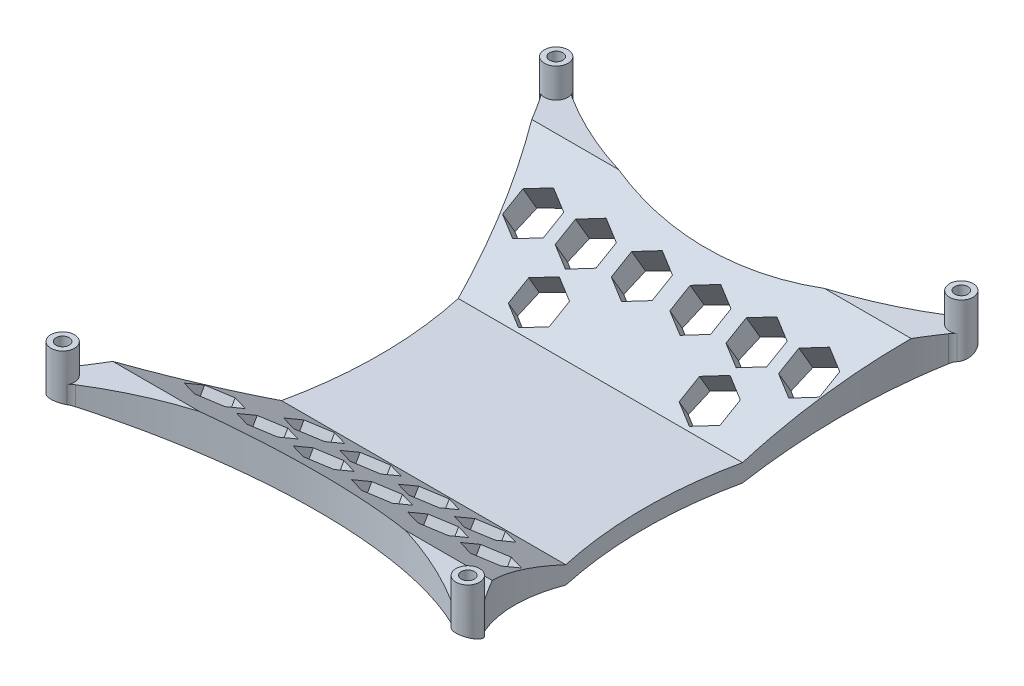
from build123d import *

# Parameters (mm, degrees)
SKETCH2_R                       = 1.4224
BOSS_EXTRUDE1_DEPTH             = 19.05
CUT_EXTRUDE1_DEPTH              = 143.46448246
CUT_EXTRUDE3_DEPTH              = 143.46448246
CUT_EXTRUDE3_DEPTH_BACK         = 143.46448246
SKETCH5_R                       = 2.54
SKETCH5_R_2                     = 1.4224
BOSS_EXTRUDE2_DEPTH             = 6.35
BOSS_EXTRUDE3_DEPTH             = 7.9375
BOSS_EXTRUDE4_REACH             = 145.452
BOSS_EXTRUDE4_DIRECTION_2_REACH = 145.452
BOSS_EXTRUDE5_REACH             = 145.452
SKETCH8_R                       = 6.35
CUT_EXTRUDE4_DEPTH              = 140.610682758
CUT_EXTRUDE5_DEPTH              = 7.9375


with BuildPart() as part:
    # Sketch2 → Boss-Extrude1 (new body)
    with BuildSketch(Plane(origin=(0, 0, 0), x_dir=(1, 0, 0), z_dir=(0, 1, 0))):
        with BuildLine():
            Line((4.399409051, -106.3625), (82.913090949, -106.3625))
            ThreePointArc((82.913090949, -106.3625), (84.183090949, -106.702795474), (85.112795474, -107.6325))
            ThreePointArc((85.112795474, -107.6325), (86.0425, -108.562204526), (87.3125, -108.9025))
            ThreePointArc((87.3125, -108.9025), (89.108551224, -108.158551224), (89.8525, -106.3625))
            ThreePointArc((89.8525, -106.3625), (89.512204526, -105.0925), (88.5825, -104.162795474))
            ThreePointArc((88.5825, -104.162795474), (87.652795474, -103.233090949), (87.3125, -101.963090949))
            Line((87.3125, -101.963090949), (87.3125, -4.399409051))
            ThreePointArc((87.3125, -4.399409051), (87.652795474, -3.129409051), (88.5825, -2.199704526))
            ThreePointArc((88.5825, -2.199704526), (89.512204526, -1.27), (89.8525, 0))
            ThreePointArc((89.8525, 0), (89.108551224, 1.796051224), (87.3125, 2.54))
            ThreePointArc((87.3125, 2.54), (86.0425, 2.199704526), (85.112795474, 1.27))
            ThreePointArc((85.112795474, 1.27), (84.183090949, 0.340295474), (82.913090949, 0))
            Line((82.913090949, 0), (4.399409051, 0))
            ThreePointArc((4.399409051, 0), (3.129409051, 0.340295474), (2.199704526, 1.27))
            ThreePointArc((2.199704526, 1.27), (1.27, 2.199704526), (0, 2.54))
            ThreePointArc((0, 2.54), (-1.796051224, 1.796051224), (-2.54, 0))
            ThreePointArc((-2.54, 0), (-2.199704526, -1.27), (-1.27, -2.199704526))
            ThreePointArc((-1.27, -2.199704526), (-0.340295474, -3.129409051), (0, -4.399409051))
            Line((0, -4.399409051), (0, -101.963090949))
            ThreePointArc((0, -101.963090949), (-0.340295474, -103.233090949), (-1.27, -104.162795474))
            ThreePointArc((-1.27, -104.162795474), (-2.199704526, -105.0925), (-2.54, -106.3625))
            ThreePointArc((-2.54, -106.3625), (-1.796051224, -108.158551224), (0, -108.9025))
            ThreePointArc((0, -108.9025), (1.27, -108.562204526), (2.199704526, -107.6325))
            ThreePointArc((2.199704526, -107.6325), (3.129409051, -106.702795474), (4.399409051, -106.3625))
        make_face()
        with Locations(Location((0, 0, 0), (0, 0, 90))):
            Circle(SKETCH2_R, mode=Mode.SUBTRACT)
        with Locations(Location((87.3125, 0, 0), (0, 0, 90))):
            Circle(SKETCH2_R, mode=Mode.SUBTRACT)
        with Locations(Location((0, -106.3625, 0), (0, 0, 90))):
            Circle(SKETCH2_R, mode=Mode.SUBTRACT)
        with Locations(Location((87.3125, -106.3625, 0), (0, 0, 90))):
            Circle(SKETCH2_R, mode=Mode.SUBTRACT)
    extrude(amount=BOSS_EXTRUDE1_DEPTH)

    # Sketch3 → Cut-Extrude1 (cut, through all)
    with BuildSketch(Plane.XZ):
        with BuildLine():
            Line((3.129409051, 106.702795474), (84.183090949, 106.702795474))
            ThreePointArc((84.183090949, 106.702795474), (43.65625, 95.031976181), (3.129409051, 106.702795474))
        make_face()
        with BuildLine():
            Line((-0.340295474, 103.233090949), (-0.340295474, 3.129409051))
            ThreePointArc((-0.340295474, 3.129409051), (15.088463774, 53.18125), (-0.340295474, 103.233090949))
        make_face()
        with BuildLine():
            Line((3.129409051, -0.340295474), (84.183090949, -0.340295474))
            ThreePointArc((84.183090949, -0.340295474), (43.65625, 11.330523819), (3.129409051, -0.340295474))
        make_face()
        with BuildLine():
            Line((87.652795474, 103.233090949), (87.652795474, 3.129409051))
            ThreePointArc((87.652795474, 3.129409051), (72.224036226, 53.18125), (87.652795474, 103.233090949))
        make_face()
    extrude(amount=-CUT_EXTRUDE1_DEPTH, mode=Mode.SUBTRACT)

    # Sketch4 → Cut-Extrude3 (cut, two sides: drawn at the far end of the back side and taken through both)
    with BuildSketch(Plane(origin=(0, 0, 0), x_dir=(0, 0, -1), z_dir=(1, 0, 0)).offset(-CUT_EXTRUDE3_DEPTH_BACK)):
        Polygon((-108.9025, 15.875), (-108.9025, 0), (-72.23125, 0), align=None)
        Polygon((-98.333998438, 19.05), (-72.23125, 3.81), (-34.13125, 3.81), (-8.028501562, 19.05), align=None)
        Polygon((-34.13125, 0), (2.54, 15.875), (2.54, 0), align=None)
    extrude(amount=CUT_EXTRUDE3_DEPTH + CUT_EXTRUDE3_DEPTH_BACK, mode=Mode.SUBTRACT)

    # Sketch5 → Boss-Extrude2 (add)
    # profile 1 of 4: a face of its own
    with BuildSketch(Plane(origin=(0, 19.05, 0), x_dir=(1, 0, 0), z_dir=(0, 1, 0))):
        with Locations(Location((0, 0, 0), (0, 0, 30))):
            Circle(SKETCH5_R)
        with Locations(Location((0, 0, 0), (0, 0, 270))):
            Circle(SKETCH5_R_2, mode=Mode.SUBTRACT)
    # profile 2 of 4: a face of its own
    with BuildSketch(Plane(origin=(0, 19.05, 0), x_dir=(1, 0, 0), z_dir=(0, 1, 0))):
        with Locations(Location((87.3125, 0, 0), (0, 0, 150))):
            Circle(SKETCH5_R)
        with Locations(Location((87.3125, 0, 0), (0, 0, 270))):
            Circle(SKETCH5_R_2, mode=Mode.SUBTRACT)
    # profile 3 of 4: a face of its own
    with BuildSketch(Plane(origin=(0, 19.05, 0), x_dir=(1, 0, 0), z_dir=(0, 1, 0))):
        with Locations(Location((87.3125, -106.3625, 0), (0, 0, 60))):
            Circle(SKETCH5_R)
        with Locations(Location((87.3125, -106.3625, 0), (0, 0, 90))):
            Circle(SKETCH5_R_2, mode=Mode.SUBTRACT)
    # profile 4 of 4: a face of its own
    with BuildSketch(Plane(origin=(0, 19.05, 0), x_dir=(1, 0, 0), z_dir=(0, 1, 0))):
        with Locations(Location((0, -106.3625, 0), (0, 0, 120))):
            Circle(SKETCH5_R)
        with Locations(Location((0, -106.3625, 0), (0, 0, 90))):
            Circle(SKETCH5_R_2, mode=Mode.SUBTRACT)
    extrude(amount=BOSS_EXTRUDE2_DEPTH)

    # Sketch6 → Boss-Extrude3 (add)
    with BuildSketch(Plane.XZ):
        with BuildLine():
            Line((29.81325, 62.606225546), (29.81325, 70.680274454))
            ThreePointArc((29.81325, 70.680274454), (29.387260417, 71.364190385), (28.585583333, 71.283431611))
            Line((28.585583333, 71.283431611), (23.356606545, 67.246407157))
            ThreePointArc((23.356606545, 67.246407157), (23.060273212, 66.64325), (23.356606545, 66.040092843))
            Line((23.356606545, 66.040092843), (28.585583333, 62.003068389))
            ThreePointArc((28.585583333, 62.003068389), (29.387260417, 61.922309615), (29.81325, 62.606225546))
        make_face()
        with BuildLine():
            Line((57.49925, 62.606225546), (57.49925, 70.680274454))
            ThreePointArc((57.49925, 70.680274454), (57.925239583, 71.364190385), (58.726916667, 71.283431611))
            Line((58.726916667, 71.283431611), (63.955893455, 67.246407157))
            ThreePointArc((63.955893455, 67.246407157), (64.252226788, 66.64325), (63.955893455, 66.040092843))
            Line((63.955893455, 66.040092843), (58.726916667, 62.003068389))
            ThreePointArc((58.726916667, 62.003068389), (57.925239583, 61.922309615), (57.49925, 62.606225546))
        make_face()
    extrude(amount=BOSS_EXTRUDE3_DEPTH)

    # Boss-Extrude4: up to this face of the body (flat: up to its plane)
    boss_extrude4_end = Plane(part.part.faces().sort_by_distance((27.368435666, -7.9375, 66.64325))[0])
    # Sketch7 → Boss-Extrude4 (add, up to the picked face)
    with BuildSketch(Plane.XZ, mode=Mode.PRIVATE) as boss_extrude4_sk1:
        with BuildLine():
            Line((43.014150633, 27.470140381), (40.849365929, 24.082422054))
            ThreePointArc((40.849365929, 24.082422054), (40.823147085, 23.306061402), (41.491465296, 22.910114361))
            Line((41.491465296, 22.910114361), (45.821034704, 22.910114361))
            ThreePointArc((45.821034704, 22.910114361), (46.489352915, 23.306061402), (46.463134071, 24.082422054))
            Line((46.463134071, 24.082422054), (44.298349367, 27.470140381))
            ThreePointArc((44.298349367, 27.470140381), (43.65625, 27.821832688), (43.014150633, 27.470140381))
        make_face()
    boss_extrude4_tool1 = split(extrude(boss_extrude4_sk1.sketch, amount=BOSS_EXTRUDE4_REACH, mode=Mode.PRIVATE), bisect_by=boss_extrude4_end, keep=Keep.BOTH, mode=Mode.PRIVATE)
    add(boss_extrude4_tool1.solids().sort_by(Axis((43.65625, 0, 24.78227), (0, -1, 0)))[0])

    # Sketch7 → Boss-Extrude4 direction 2 (add, up to next)
    with BuildSketch(Plane.XZ, mode=Mode.PRIVATE) as boss_extrude4_direction_2_sk1:
        with BuildLine():
            Line((43.014150633, 27.470140381), (40.849365929, 24.082422054))
            ThreePointArc((40.849365929, 24.082422054), (40.823147085, 23.306061402), (41.491465296, 22.910114361))
            Line((41.491465296, 22.910114361), (45.821034704, 22.910114361))
            ThreePointArc((45.821034704, 22.910114361), (46.489352915, 23.306061402), (46.463134071, 24.082422054))
            Line((46.463134071, 24.082422054), (44.298349367, 27.470140381))
            ThreePointArc((44.298349367, 27.470140381), (43.65625, 27.821832688), (43.014150633, 27.470140381))
        make_face()
    boss_extrude4_direction_2_tool1 = extrude(boss_extrude4_direction_2_sk1.sketch, amount=-BOSS_EXTRUDE4_DIRECTION_2_REACH, mode=Mode.PRIVATE) - part.part
    add(boss_extrude4_direction_2_tool1.solids().sort_by_distance((43.65625, 0, 24.78227))[0])

    # Boss-Extrude5: up to this plane
    boss_extrude5_end = Plane(origin=(89.8525, 0, 34.13125), z_dir=(0, -0.9177005002227521, -0.39727294381937295))
    # Sketch8 → Boss-Extrude5 (add, up to the surface)
    with BuildSketch(Plane.XZ, mode=Mode.PRIVATE) as boss_extrude5_sk1:
        with Locations(Location((43.65625, 25.776281217, 0), (0, 0, 270))):
            Circle(SKETCH8_R)
    boss_extrude5_tool1 = split(extrude(boss_extrude5_sk1.sketch, amount=-BOSS_EXTRUDE5_REACH, mode=Mode.PRIVATE), bisect_by=boss_extrude5_end, keep=Keep.BOTH, mode=Mode.PRIVATE)
    add(boss_extrude5_tool1.solids().sort_by_distance((43.65625, 0, 25.776281))[0])

    # Sketch9 → Cut-Extrude4 (cut, through all)
    with BuildSketch(Plane(origin=(0, -28.60961339, 16.70362449), x_dir=(1, 0, 0), z_dir=(0, 0.8635859338868709, -0.5042016806722692))):
        Polygon((73.286999933, -76.74489989), (68.887590882, -79.28489989), (68.887590882, -84.36489989), (73.286999933, -86.90489989), (77.686408984, -84.36489989), (77.686408984, -79.28489989), align=None)
        Polygon((61.948181831, -76.74489989), (57.548772779, -79.28489989), (57.548772779, -84.36489989), (61.948181831, -86.90489989), (66.347590882, -84.36489989), (66.347590882, -79.28489989), align=None)
        Polygon((49.847363728, -76.74489989), (45.447954677, -79.28489989), (45.447954677, -84.36489989), (49.847363728, -86.90489989), (54.246772779, -84.36489989), (54.246772779, -79.28489989), align=None)
        Polygon((37.238545626, -76.74489989), (32.839136575, -79.28489989), (32.839136575, -84.36489989), (37.238545626, -86.90489989), (41.637954677, -84.36489989), (41.637954677, -79.28489989), align=None)
        Polygon((25.137727523, -76.74489989), (20.738318472, -79.28489989), (20.738318472, -84.36489989), (25.137727523, -86.90489989), (29.537136575, -84.36489989), (29.537136575, -79.28489989), align=None)
        Polygon((13.798909421, -76.74489989), (9.39950037, -79.28489989), (9.39950037, -84.36489989), (13.798909421, -86.90489989), (18.198318472, -84.36489989), (18.198318472, -79.28489989), align=None)
        Polygon((29.537136575, -72.68089989), (25.137727523, -75.22089989), (20.738318472, -72.68089989), (20.738318472, -67.60089989), (25.137727523, -65.06089989), (29.537136575, -67.60089989), align=None)
        Polygon((41.637954677, -72.68089989), (37.238545626, -75.22089989), (32.839136575, -72.68089989), (32.839136575, -67.60089989), (37.238545626, -65.06089989), (41.637954677, -67.60089989), align=None)
        Polygon((54.246772779, -72.68089989), (49.847363728, -75.22089989), (45.447954677, -72.68089989), (45.447954677, -67.60089989), (49.847363728, -65.06089989), (54.246772779, -67.60089989), align=None)
        Polygon((66.347590882, -72.68089989), (61.948181831, -75.22089989), (57.548772779, -72.68089989), (57.548772779, -67.60089989), (61.948181831, -65.06089989), (66.347590882, -67.60089989), align=None)
    extrude(amount=-CUT_EXTRUDE4_DEPTH, mode=Mode.SUBTRACT)

    # Sketch11 → Cut-Extrude5 (cut)
    with BuildSketch(Plane(origin=(0, 35.705856613, -20.499296022), x_dir=(1, 0, 0), z_dir=(0, -0.8635859338868708, -0.5042016806722693))):
        Polygon((73.513590579, 50.814115615), (69.114181528, 48.274115615), (69.114181528, 43.194115615), (73.513590579, 40.654115615), (77.91299963, 43.194115615), (77.91299963, 48.274115615), align=None)
        Polygon((62.174772477, 50.814115615), (57.775363425, 48.274115615), (57.775363425, 43.194115615), (62.174772477, 40.654115615), (66.574181528, 43.194115615), (66.574181528, 48.274115615), align=None)
        Polygon((50.073954374, 50.814115615), (45.674545323, 48.274115615), (45.674545323, 43.194115615), (50.073954374, 40.654115615), (54.473363425, 43.194115615), (54.473363425, 48.274115615), align=None)
        Polygon((37.465136272, 50.814115615), (33.065727221, 48.274115615), (33.065727221, 43.194115615), (37.465136272, 40.654115615), (41.864545323, 43.194115615), (41.864545323, 48.274115615), align=None)
        Polygon((25.364318169, 50.814115615), (20.964909118, 48.274115615), (20.964909118, 43.194115615), (25.364318169, 40.654115615), (29.763727221, 43.194115615), (29.763727221, 48.274115615), align=None)
        Polygon((14.025500067, 50.814115615), (9.626091016, 48.274115615), (9.626091016, 43.194115615), (14.025500067, 40.654115615), (18.424909118, 43.194115615), (18.424909118, 48.274115615), align=None)
        Polygon((29.763727221, 54.878115615), (25.364318169, 52.338115615), (20.964909118, 54.878115615), (20.964909118, 59.958115615), (25.364318169, 62.498115615), (29.763727221, 59.958115615), align=None)
        Polygon((66.574181528, 54.878115615), (62.174772477, 52.338115615), (57.775363425, 54.878115615), (57.775363425, 59.958115615), (62.174772477, 62.498115615), (66.574181528, 59.958115615), align=None)
    extrude(amount=CUT_EXTRUDE5_DEPTH, mode=Mode.SUBTRACT)


solid = part.part
